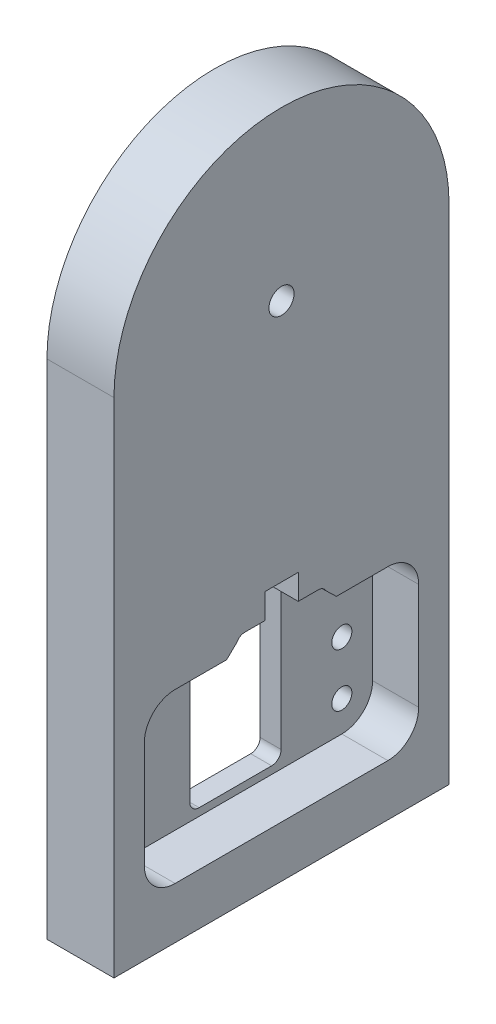
from build123d import *
from build123d.topology import SkipClean

# Parameters (mm, degrees)
SKETCH1_W                = 10
SKETCH1_H                = 80
SKETCH1_R                = 2.45
BOSS_EXTRUDE1_DEPTH      = 10
SKETCH2_W                = 10
SKETCH2_H                = 80
BOSS_EXTRUDE2_DEPTH      = 150
CUT_EXTRUDE1_DEPTH       = 166.227116419
SKETCH4_R                = 1.5
CUT_EXTRUDE2_DEPTH       = 301.861524459
SKETCH7_R                = 3.15
CUT_EXTRUDE5_DEPTH       = 10
SKETCH11_R               = 8.15
CUT_EXTRUDE7_DEPTH       = 5.2
SKETCH13_R               = 1.45
CUT_EXTRUDE8_DEPTH       = 5
CUT_EXTRUDE9_DEPTH       = 5
CUT_EXTRUDE10_DEPTH      = 5
CUT_EXTRUDE11_START      = -10
SKETCH16_R               = 2.4
CUT_EXTRUDE11_DEPTH      = 5
SKETCH17_R               = 1.5
BOSS_EXTRUDE4_DEPTH      = 6
SKETCH18_R               = 8.2
CUT_EXTRUDE12_DEPTH      = 6
SKETCH19_R               = 3
CUT_EXTRUDE13_DEPTH      = 10
SKETCH20_W               = 359.593382494
SKETCH20_H               = 674.632515804
CUT_EXTRUDE14_DEPTH      = 212.128383277
SKETCH22_R               = 1.45
CUT_EXTRUDE16_DEPTH      = 5
CUT_EXTRUDE17_DEPTH      = 166.290653093
CUT_EXTRUDE17_DEPTH_BACK = 166.290653093
CUT_EXTRUDE18_DEPTH      = 166.698521418
CUT_EXTRUDE18_DEPTH_BACK = 166.698521418
SKETCH24_W               = 8
SKETCH24_H               = 6


with BuildPart() as part:
    # Sketch1 → Boss-Extrude1 (new body)
    with BuildSketch(Plane(origin=(0, 0, 0), x_dir=(1, 0, 0), z_dir=(0, 1, 0))):
        with Locations((-120.815, 0)):
            Rectangle(SKETCH1_W, SKETCH1_H)
        with Locations(Location((-120.815, -31.75, 0), (0, 0, 270))):
            Circle(SKETCH1_R, mode=Mode.SUBTRACT)
        with Locations(Location((-120.815, -19.05, 0), (0, 0, 270))):
            Circle(SKETCH1_R, mode=Mode.SUBTRACT)
        with Locations(Location((-120.815, -6.35, 0), (0, 0, 270))):
            Circle(SKETCH1_R, mode=Mode.SUBTRACT)
        with Locations(Location((-120.815, 6.35, 0), (0, 0, 270))):
            Circle(SKETCH1_R, mode=Mode.SUBTRACT)
        with Locations(Location((-120.815, 19.05, 0), (0, 0, 270))):
            Circle(SKETCH1_R, mode=Mode.SUBTRACT)
        with Locations(Location((-120.815, 31.75, 0), (0, 0, 270))):
            Circle(SKETCH1_R, mode=Mode.SUBTRACT)
    extrude(amount=BOSS_EXTRUDE1_DEPTH)

    # Sketch2 → Boss-Extrude2 (add)
    with BuildSketch(Plane(origin=(0, 10, 0), x_dir=(1, 0, 0), z_dir=(0, 1, 0))):
        with Locations((-120.815, 0)):
            Rectangle(SKETCH2_W, SKETCH2_H)
    extrude(amount=BOSS_EXTRUDE2_DEPTH)

    # Sketch3 → Cut-Extrude1 (cut, through all)
    with BuildSketch(Plane.ZY.offset(125.815)):
        with BuildLine():
            Line((-40, 120), (-60, 120))
            Line((-60, 120), (-60, 170))
            Line((-60, 170), (60, 170))
            Line((60, 170), (60, 120))
            Line((60, 120), (40, 120))
            ThreePointArc((40, 120), (0, 160), (-40, 120))
        make_face()
    extrude(amount=-CUT_EXTRUDE1_DEPTH, mode=Mode.SUBTRACT)


with BuildPart() as body_2:
    # Mirror1: mirrored copy
    add(part.part.mirror(Plane(origin=(0, 0, 0), x_dir=(0, 0, 1), z_dir=(1, 0, 0))))


with BuildPart() as cut_extrude2_tool:
    # Sketch4 → Cut-Extrude2 (new, through all)
    with BuildSketch(Plane.ZY.offset(125.815)):
        with Locations((0, 120)):
            Circle(SKETCH4_R)
    extrude(amount=-CUT_EXTRUDE2_DEPTH)


with BuildPart() as part_1:
    add(part.part)

    # Cut-Extrude2: cut by cut_extrude2_tool
    add(cut_extrude2_tool.part, mode=Mode.SUBTRACT)

    # Sketch7 → Cut-Extrude5 (cut)
    with BuildSketch(Plane.ZY.offset(125.815)):
        with Locations((0, 120)):
            Circle(SKETCH7_R)
    extrude(amount=-CUT_EXTRUDE5_DEPTH, mode=Mode.SUBTRACT)

    # Sketch11 → Cut-Extrude7 (cut)
    with BuildSketch(Plane.ZY.offset(125.815)):
        with Locations((0, 120)):
            Circle(SKETCH11_R)
    extrude(amount=-CUT_EXTRUDE7_DEPTH, mode=Mode.SUBTRACT)

    # Sketch13 → Cut-Extrude8 (cut)
    with BuildSketch(Plane.ZY.offset(125.815)):
        with Locations((-12.5, 132.5)):
            Circle(SKETCH13_R)
        with Locations((12.5, 132.5)):
            Circle(SKETCH13_R)
        with Locations((12.5, 107.5)):
            Circle(SKETCH13_R)
        with Locations((-12.5, 107.5)):
            Circle(SKETCH13_R)
    extrude(amount=-CUT_EXTRUDE8_DEPTH, mode=Mode.SUBTRACT)

    # Sketch20 → Cut-Extrude14 (cut, through all)
    with BuildSketch(Plane(origin=(0, 0, 0), x_dir=(0, 0, -1), z_dir=(1, 0, 0))):
        Rectangle(SKETCH20_W, SKETCH20_H)
    extrude(amount=-CUT_EXTRUDE14_DEPTH, mode=Mode.SUBTRACT)


with BuildPart() as body_2_1:
    add(body_2.part)

    # Cut-Extrude2: cut by cut_extrude2_tool
    add(cut_extrude2_tool.part, mode=Mode.SUBTRACT)

    # Sketch14 → Cut-Extrude9 (cut)
    with BuildSketch(Plane(origin=(125.815, 0, 0), x_dir=(0, 0, -1), z_dir=(1, 0, 0))):
        with BuildLine():
            Line((25.4, 52.35), (13.104540125, 52.35))
            Line((13.104540125, 52.35), (10.650485711, 54.724046033))
            ThreePointArc((10.650485711, 54.724046033), (9.859214258, 55.56214504), (8.748782119, 55.871112549))
            Line((8.748782119, 55.871112549), (-8.748782119, 55.871112549))
            ThreePointArc((-8.748782119, 55.871112549), (-9.859214258, 55.56214504), (-10.650485712, 54.724046033))
            Line((-10.650485712, 54.724046033), (-13.104540125, 52.35))
            Line((-13.104540125, 52.35), (-25.4, 52.35))
            ThreePointArc((-25.4, 52.35), (-30.597234842, 50.197234842), (-32.75, 45))
            Line((-32.75, 45), (-32.75, 19.6))
            ThreePointArc((-32.75, 19.6), (-30.597234842, 14.402765158), (-25.4, 12.25))
            Line((-25.4, 12.25), (25.4, 12.25))
            ThreePointArc((25.4, 12.25), (30.597234842, 14.402765158), (32.75, 19.6))
            Line((32.75, 19.6), (32.75, 45))
            ThreePointArc((32.75, 45), (30.597234842, 50.197234842), (25.4, 52.35))
        make_face()
    extrude(amount=-CUT_EXTRUDE9_DEPTH, mode=Mode.SUBTRACT)

    # Sketch15 → Cut-Extrude10 (cut)
    with BuildSketch(Plane.ZY.offset(-115.815)):
        with BuildLine():
            Line((-9.899563657, 53.597002723), (-9.899563657, 16.29781068))
            ThreePointArc((-9.899563657, 16.29781068), (-9.533461074, 15.41396086), (-8.649611253, 15.047858277))
            Line((-8.649611253, 15.047858277), (8.649611253, 15.047858277))
            ThreePointArc((8.649611253, 15.047858277), (9.533461074, 15.41396086), (9.899563657, 16.29781068))
            Line((9.899563657, 16.29781068), (9.899563657, 53.597002723))
            ThreePointArc((9.899563657, 53.597002723), (9.607232135, 54.489704444), (8.748802207, 54.871112548))
            Line((8.748802207, 54.871112548), (-8.748802207, 54.871112548))
            ThreePointArc((-8.748802207, 54.871112548), (-9.607232135, 54.489704444), (-9.899563657, 53.597002723))
        make_face()
    extrude(amount=-CUT_EXTRUDE10_DEPTH, mode=Mode.SUBTRACT)

    # Sketch16 → Cut-Extrude11 (cut)
    with BuildSketch(Plane(origin=(125.815, 0, 0), x_dir=(0, 0, -1), z_dir=(1, 0, 0)).offset(CUT_EXTRUDE11_START)):
        with Locations((-25.4, 45)):
            Circle(SKETCH16_R)
        with Locations((-25.4, 32.3)):
            Circle(SKETCH16_R)
        with Locations((-25.4, 19.6)):
            Circle(SKETCH16_R)
        with Locations((25.4, 19.6)):
            Circle(SKETCH16_R)
        with Locations((25.4, 32.3)):
            Circle(SKETCH16_R)
        with Locations((25.4, 45)):
            Circle(SKETCH16_R)
    extrude(amount=CUT_EXTRUDE11_DEPTH, mode=Mode.SUBTRACT)

    # Sketch17 → Boss-Extrude4 (add)
    with SkipClean():  # the faces are left unmerged after this step: merging them gives an invalid solid
        with BuildSketch(Plane(origin=(125.815, 0, 0), x_dir=(0, 0, -1), z_dir=(1, 0, 0))):
            with BuildLine():
                ThreePointArc((40, 120), (0, 160), (-40, 120))
                Line((-40, 120), (-40, 0))
                Line((-40, 0), (40, 0))
                Line((40, 0), (40, 120))
            make_face()
            with BuildLine():
                Line((-13.104540125, 52.35), (-10.650485712, 54.724046033))
                ThreePointArc((-10.650485712, 54.724046033), (-9.859214258, 55.56214504), (-8.748782119, 55.871112549))
                Line((-8.748782119, 55.871112549), (8.748782119, 55.871112549))
                ThreePointArc((8.748782119, 55.871112549), (9.859214258, 55.56214504), (10.650485711, 54.724046033))
                Line((10.650485711, 54.724046033), (13.104540125, 52.35))
                Line((13.104540125, 52.35), (25.4, 52.35))
                ThreePointArc((25.4, 52.35), (30.597234842, 50.197234842), (32.75, 45))
                Line((32.75, 45), (32.75, 19.6))
                ThreePointArc((32.75, 19.6), (30.597234842, 14.402765158), (25.4, 12.25))
                Line((25.4, 12.25), (-25.4, 12.25))
                ThreePointArc((-25.4, 12.25), (-30.597234842, 14.402765158), (-32.75, 19.6))
                Line((-32.75, 19.6), (-32.75, 45))
                ThreePointArc((-32.75, 45), (-30.597234842, 50.197234842), (-25.4, 52.35))
                Line((-25.4, 52.35), (-13.104540125, 52.35))
            make_face(mode=Mode.SUBTRACT)
            with Locations((0, 120)):
                Circle(SKETCH17_R, mode=Mode.SUBTRACT)
        extrude(amount=BOSS_EXTRUDE4_DEPTH)

    # Sketch18 → Cut-Extrude12 (cut)
    with SkipClean():  # the faces are left unmerged after this step: merging them gives an invalid solid
        with BuildSketch(Plane(origin=(115.815, 0, 0), x_dir=(0, 0, -1), z_dir=(1, 0, 0))):
            with Locations((0, 120)):
                Circle(SKETCH18_R)
        extrude(amount=CUT_EXTRUDE12_DEPTH, mode=Mode.SUBTRACT)

    # Sketch19 → Cut-Extrude13 (cut)
    with BuildSketch(Plane.ZY.offset(-121.815)):
        with Locations((0, 120)):
            Circle(SKETCH19_R)
    extrude(amount=-CUT_EXTRUDE13_DEPTH, mode=Mode.SUBTRACT)

    # Sketch22 → Cut-Extrude16 (cut)
    with BuildSketch(Plane.ZY.offset(-115.815)):
        with Locations((-12.5, 107.5)):
            Circle(SKETCH22_R)
        with Locations((12.5, 107.5)):
            Circle(SKETCH22_R)
        with Locations((12.5, 132.5)):
            Circle(SKETCH22_R)
        with Locations((-12.5, 132.5)):
            Circle(SKETCH22_R)
    extrude(amount=-CUT_EXTRUDE16_DEPTH, mode=Mode.SUBTRACT)

    # Sketch23 → Cut-Extrude17 (cut, two sides: drawn at the far end of the back side and taken through both)
    with BuildSketch(Plane(origin=(120.815, 0, 0), x_dir=(0, 0, -1), z_dir=(1, 0, 0)).offset(-CUT_EXTRUDE17_DEPTH_BACK)):
        with BuildLine():
            Line((-8.649611253, 14.047858277), (8.649611253, 14.047858277))
            ThreePointArc((8.649611253, 14.047858277), (10.240567855, 14.706854078), (10.899563657, 16.29781068))
            Line((10.899563657, 16.29781068), (10.899563657, 53.554008783))
            ThreePointArc((10.899563657, 53.554008783), (10.329525513, 55.181625261), (8.748802207, 55.871112548))
            Line((8.748802207, 55.871112548), (-8.748802207, 55.871112548))
            ThreePointArc((-8.748802207, 55.871112548), (-10.329525513, 55.181625261), (-10.899563657, 53.554008783))
            Line((-10.899563657, 53.554008783), (-10.899563657, 16.29781068))
            ThreePointArc((-10.899563657, 16.29781068), (-10.240567855, 14.706854078), (-8.649611253, 14.047858277))
        make_face()
    extrude(amount=CUT_EXTRUDE17_DEPTH + CUT_EXTRUDE17_DEPTH_BACK, mode=Mode.SUBTRACT)

    # Sketch24 → Cut-Extrude18 (cut, two sides: drawn at the far end of the back side and taken through both)
    with BuildSketch(Plane(origin=(131.815, 0, 0), x_dir=(0, 0, -1), z_dir=(1, 0, 0)).offset(-CUT_EXTRUDE18_DEPTH_BACK)):
        with Locations((0, 58.871112549)):
            Rectangle(SKETCH24_W, SKETCH24_H)
    extrude(amount=CUT_EXTRUDE18_DEPTH + CUT_EXTRUDE18_DEPTH_BACK, mode=Mode.SUBTRACT)


solid = body_2_1.part
